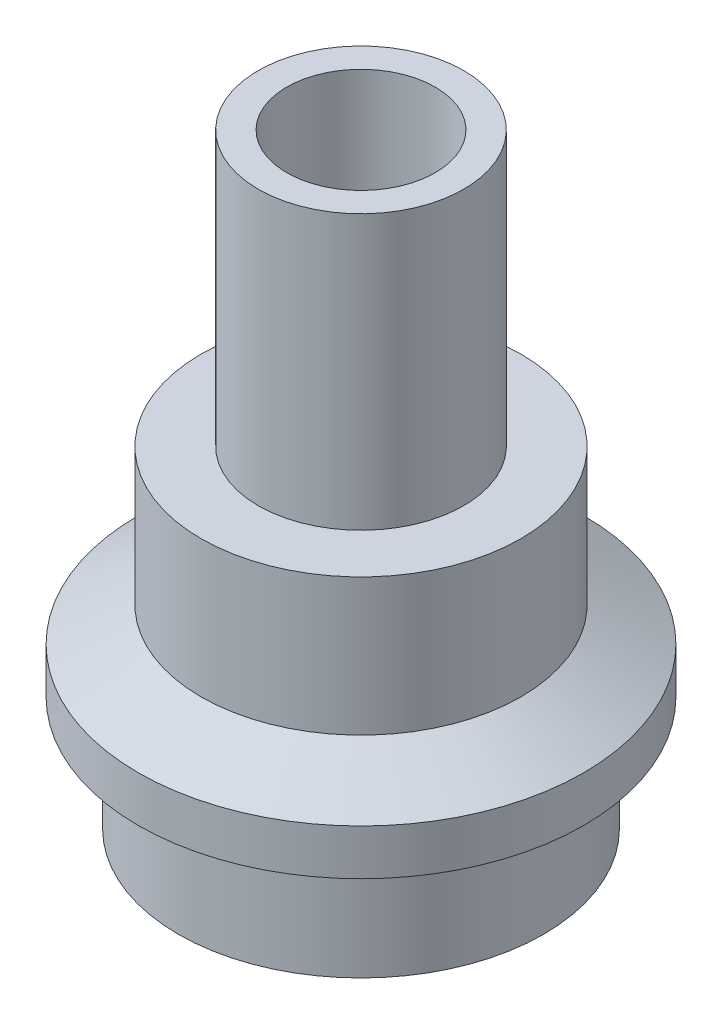
from build123d import *


with BuildPart() as part:
    # Sketch1 → Revolve1 (revolve)
    with BuildSketch(Plane.XY, mode=Mode.PRIVATE) as revolve1_sk:
        Polygon((11, 0), (16, 0), (16, 10), (19.5, 10), (19.5, 14), (14, 17), (14, 29), (9, 29), (9, 53), (6.5, 53), (6.5, 41), (3, 40), (3, 38), (3.5, 38), (3.5, 11), (11, 11), align=None)
    revolve(revolve1_sk.sketch.rotate(Axis((0, 0, 0), (0, 1, 0)), 90), axis=Axis((0, 0, 0), (0, 1, 0)))


solid = part.part
